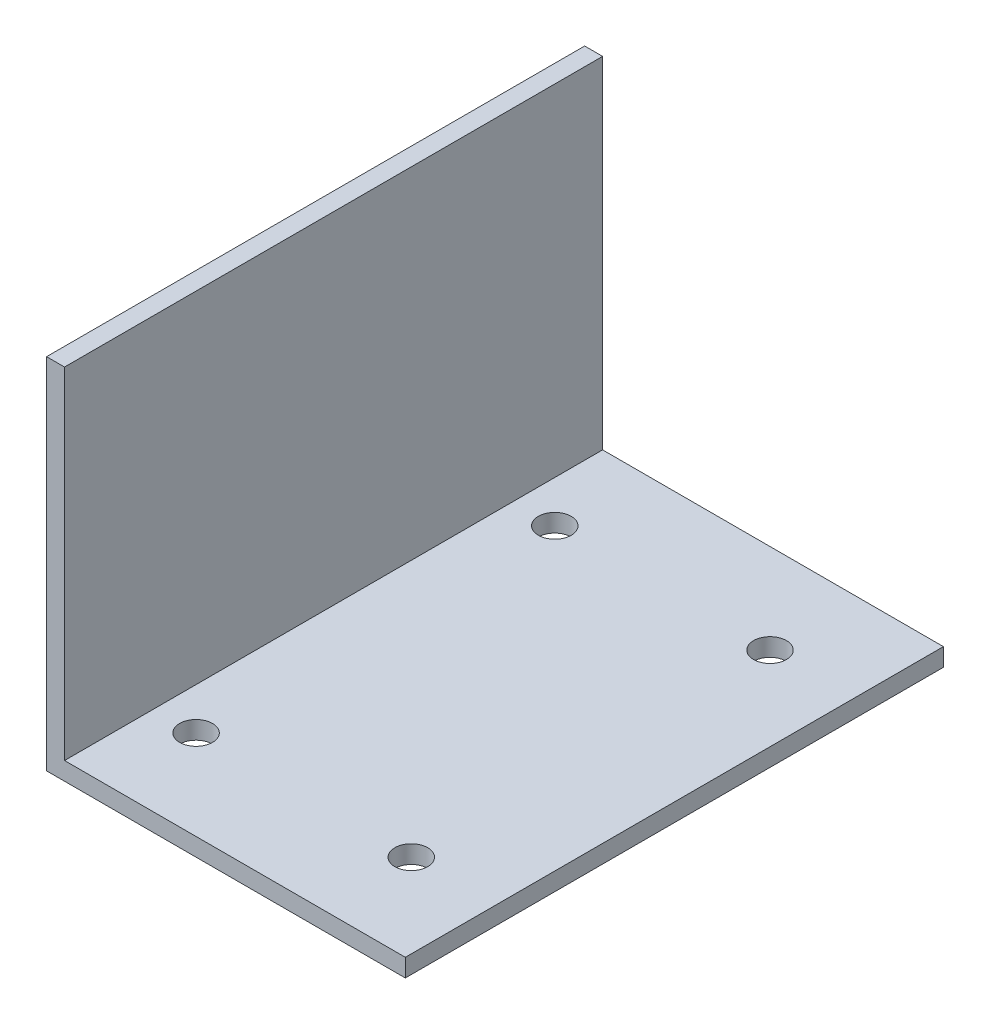
from build123d import *

# Parameters (mm, degrees)
EXTRUDE_1_DEPTH     = 90
SKETCH_2_R          = 2.75
CUT_EXTRUDE_1_DEPTH = 124.693168769


with BuildPart() as part:
    # Эскиз1 → Бобышка-Вытянуть1 (new body)
    with BuildSketch(Plane.XY):
        Polygon((0, 0), (0, 60), (3, 60), (3, 3), (60, 3), (60, 0), align=None)
    extrude(amount=EXTRUDE_1_DEPTH)

    # Эскиз2 → Вырез-Вытянуть1 (cut, through all)
    with BuildSketch(Plane.XZ):
        with Locations((10, 75)):
            Circle(SKETCH_2_R)
        with Locations((46, 75)):
            Circle(SKETCH_2_R)
        with Locations((46, 15)):
            Circle(SKETCH_2_R)
        with Locations((10, 15)):
            Circle(SKETCH_2_R)
    extrude(amount=-CUT_EXTRUDE_1_DEPTH, mode=Mode.SUBTRACT)


solid = part.part
